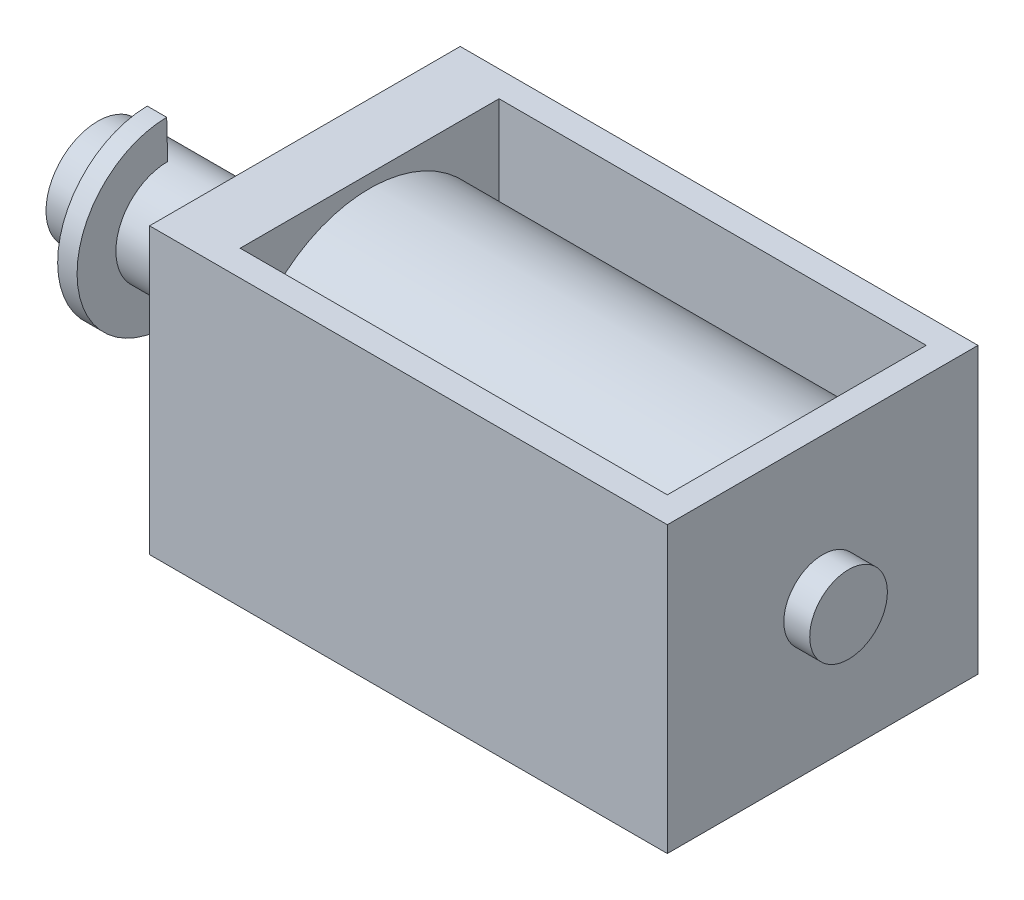
from build123d import *

# Parameters (mm, degrees)
SKETCH1_W           = 20
SKETCH1_H           = 12
BOSS_EXTRUDE1_DEPTH = 11
SKETCH3_W           = 16.5
SKETCH3_H           = 10
CUT_EXTRUDE1_DEPTH  = 26.787593916
BOSS_EXTRUDE3_REACH = 25.901
SKETCH4_R           = 5
SKETCH5_R           = 2
BOSS_EXTRUDE4_DEPTH = 8
SKETCH6_R           = 1.5
BOSS_EXTRUDE5_DEPTH = 1
BOSS_EXTRUDE6_DEPTH = 0.75


with BuildPart() as part:
    # Sketch1 → Boss-Extrude1 (new body)
    with BuildSketch(Plane(origin=(0, 0, 0), x_dir=(1, 0, 0), z_dir=(0, 1, 0))):
        with Locations((10, 6)):
            Rectangle(SKETCH1_W, SKETCH1_H)
    extrude(amount=BOSS_EXTRUDE1_DEPTH)

    # Sketch3 → Cut-Extrude1 (cut, through all)
    with BuildSketch(Plane(origin=(0, 11, 0), x_dir=(1, 0, 0), z_dir=(0, 1, 0))):
        with Locations((10.75, 6)):
            Rectangle(SKETCH3_W, SKETCH3_H)
    extrude(amount=-CUT_EXTRUDE1_DEPTH, mode=Mode.SUBTRACT)


with BuildPart() as body_2:

    # Sketch4 → Boss-Extrude3 (new, up to next)
    with BuildSketch(Plane(origin=(2.5, 0, 0), x_dir=(0, 0, -1), z_dir=(1, 0, 0)), mode=Mode.PRIVATE) as boss_extrude3_sk1:
        with Locations((6, 5.5)):
            Circle(SKETCH4_R)
    boss_extrude3_tool1 = extrude(boss_extrude3_sk1.sketch, amount=BOSS_EXTRUDE3_REACH, mode=Mode.PRIVATE) - part.part
    add(boss_extrude3_tool1.solids().sort_by_distance((2.5, 5.5, -6))[0])


with BuildPart() as part_1:
    add(part.part)

    # Sketch5 → Boss-Extrude4 (add)
    with BuildSketch(Plane.ZY):
        with Locations(Location((-6, 5.5, 0), (0, 0, 180))):
            Circle(SKETCH5_R)
    extrude(amount=BOSS_EXTRUDE4_DEPTH)

    # Sketch6 → Boss-Extrude5 (add)
    with BuildSketch(Plane(origin=(20, 0, 0), x_dir=(0, 0, -1), z_dir=(1, 0, 0))):
        with Locations(Location((6, 5.5, 0), (0, 0, 180))):
            Circle(SKETCH6_R)
    extrude(amount=BOSS_EXTRUDE5_DEPTH)

    # Sketch7 → Boss-Extrude6 (add)
    with BuildSketch(Plane.ZY.offset(5.3)):
        with BuildLine():
            Line((-6, 7.5), (-5.961540784, 8.999788692))
            ThreePointArc((-5.961540784, 8.999788692), (-2.500052827, 5.480770102), (-6, 2))
            Line((-6, 2), (-6, 3.5))
            ThreePointArc((-6, 3.5), (-4, 5.5), (-6, 7.5))
        make_face()
    extrude(amount=BOSS_EXTRUDE6_DEPTH)


solid = Compound([body_2.part, part_1.part])
